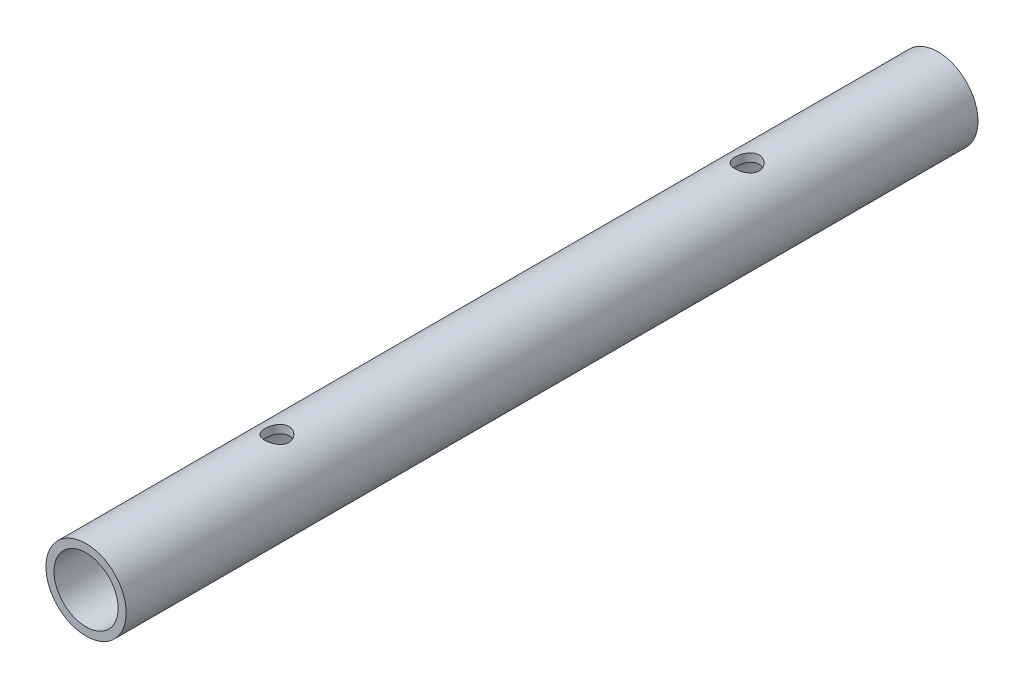
from build123d import *

# Parameters (mm, degrees)
SKETCH1_R               = 5
BOSS_EXTRUDE1_DEPTH     = 106.148
CUT_EXTRUDE1_REACH      = 108.383
SKETCH2_R               = 4
CUT_EXTRUDE2_DEPTH      = 107.38325951
CUT_EXTRUDE2_DEPTH_BACK = 107.38325951
SKETCH5_R               = 1.5


with BuildPart() as part:
    # Sketch1 → Boss-Extrude1 (new body)
    with BuildSketch(Plane.XY):
        Circle(SKETCH1_R)
    extrude(amount=BOSS_EXTRUDE1_DEPTH)

    # Sketch2 → Cut-Extrude1 (cut, up to next)
    with BuildSketch(Plane.XY.offset(106.148), mode=Mode.PRIVATE) as cut_extrude1_sk1:
        Circle(SKETCH2_R)
    cut_extrude1_tool1 = extrude(cut_extrude1_sk1.sketch, amount=-CUT_EXTRUDE1_REACH, mode=Mode.PRIVATE) & part.part
    add(cut_extrude1_tool1.solids().sort_by_distance((0, 0, 106.148))[0], mode=Mode.SUBTRACT)

    # Sketch5 → Cut-Extrude2 (cut, two sides: drawn at the far end of the back side and taken through both)
    with BuildSketch(Plane(origin=(0, 0, 0), x_dir=(1, 0, 0), z_dir=(0, 1, 0)).offset(-CUT_EXTRUDE2_DEPTH_BACK)):
        with Locations(Location((0, -23.777, 0), (0, 0, 270))):
            Circle(SKETCH5_R)
        with Locations(Location((0, -82.371, 0), (0, 0, 270))):
            Circle(SKETCH5_R)
    extrude(amount=CUT_EXTRUDE2_DEPTH + CUT_EXTRUDE2_DEPTH_BACK, mode=Mode.SUBTRACT)


solid = part.part
